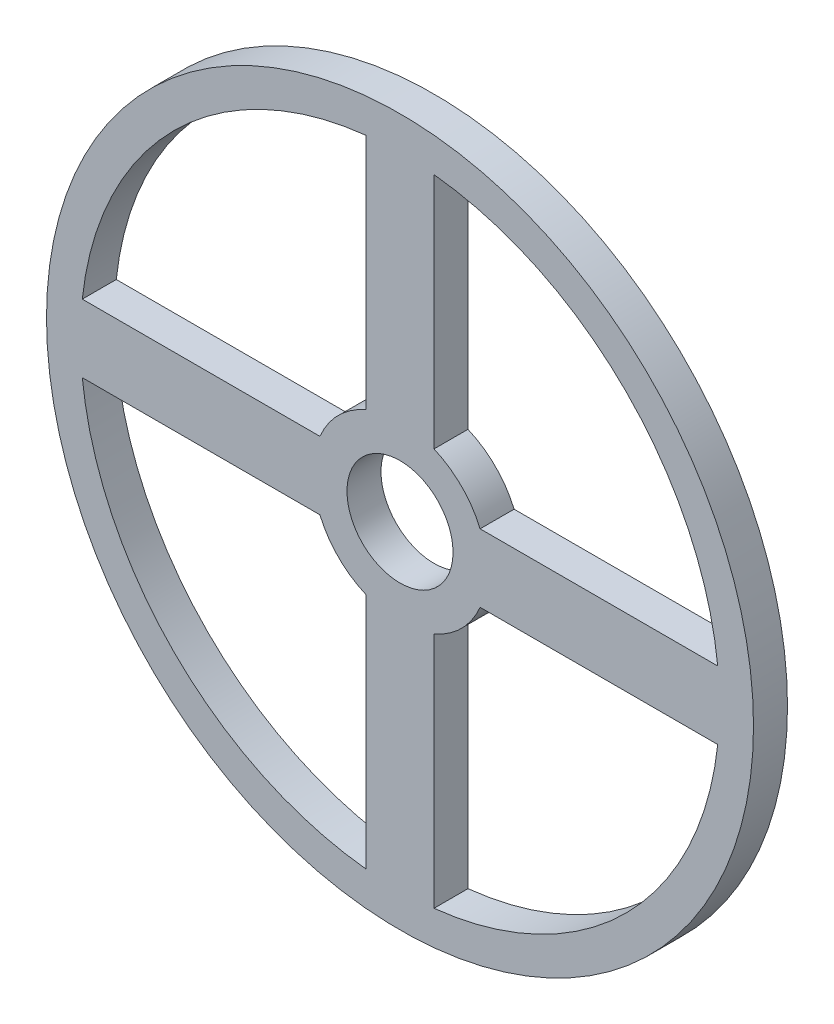
from build123d import *

# Parameters (mm, degrees)
SKETCH1_R           = 33.02
SKETCH1_R_2         = 4.953
BOSS_EXTRUDE1_DEPTH = 3.175


with BuildPart() as part:
    # Sketch1 → Boss-Extrude1 (new body)
    with BuildSketch(Plane.XY):
        Circle(SKETCH1_R)
        Circle(SKETCH1_R_2, mode=Mode.SUBTRACT)
        with BuildLine():
            Line((-7.482229547, 3.175), (-29.675636472, 3.175))
            ThreePointArc((-29.675636472, 3.175), (-21.103601885, 21.103601885), (-3.175, 29.675636472))
            Line((-3.175, 29.675636472), (-3.175, 7.482229547))
            ThreePointArc((-3.175, 7.482229547), (-5.747363917, 5.747363917), (-7.482229547, 3.175))
        make_face(mode=Mode.SUBTRACT)
        with BuildLine():
            Line((3.175, 7.482229547), (3.175, 29.675636472))
            ThreePointArc((3.175, 29.675636472), (21.103601885, 21.103601885), (29.675636472, 3.175))
            Line((29.675636472, 3.175), (7.482229547, 3.175))
            ThreePointArc((7.482229547, 3.175), (5.747363917, 5.747363917), (3.175, 7.482229547))
        make_face(mode=Mode.SUBTRACT)
        with BuildLine():
            Line((7.482229547, -3.175), (29.675636472, -3.175))
            ThreePointArc((29.675636472, -3.175), (21.103601885, -21.103601885), (3.175, -29.675636472))
            Line((3.175, -29.675636472), (3.175, -7.482229547))
            ThreePointArc((3.175, -7.482229547), (5.747363917, -5.747363917), (7.482229547, -3.175))
        make_face(mode=Mode.SUBTRACT)
        with BuildLine():
            Line((-3.175, -7.482229547), (-3.175, -29.675636472))
            ThreePointArc((-3.175, -29.675636472), (-21.103601885, -21.103601885), (-29.675636472, -3.175))
            Line((-29.675636472, -3.175), (-7.482229547, -3.175))
            ThreePointArc((-7.482229547, -3.175), (-5.747363917, -5.747363917), (-3.175, -7.482229547))
        make_face(mode=Mode.SUBTRACT)
    extrude(amount=BOSS_EXTRUDE1_DEPTH)


solid = part.part
